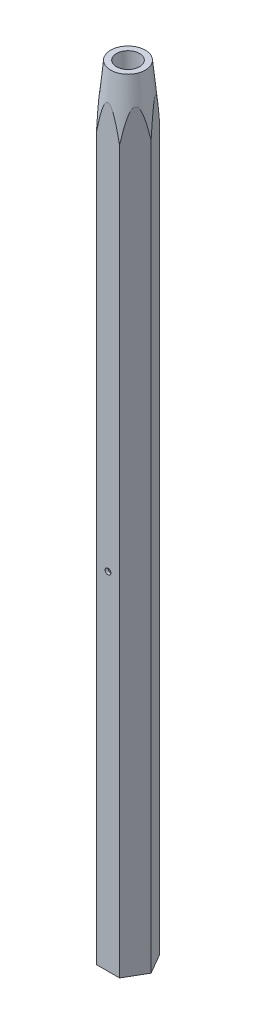
from build123d import *

# Parameters (mm, degrees)
CROQUIS1_R              = 4
CROQUIS1_R_2            = 3
SALIENTE_EXTRUIR1_DEPTH = 125
CORTAR_EXTRUIR1_DEPTH   = 136.11846654
REDONDEO1_R             = 4
CROQUIS15_R             = 3.25
CROQUIS15_R_2           = 3.15
CORTAR_EXTRUIR2_DEPTH   = 0.05
CROQUIS17_R             = 0.5
CORTAR_EXTRUIR3_DEPTH   = 1


with BuildPart() as part:
    # Croquis1 → Saliente-Extruir1 (new body)
    with BuildSketch(Plane(origin=(0, 0, 0), x_dir=(1, 0, 0), z_dir=(0, 1, 0))):
        with Locations(Location((0, 0, 0), (0, 0, 270))):
            Circle(CROQUIS1_R)
        with Locations(Location((0, 0, 0), (0, 0, 270))):
            Circle(CROQUIS1_R_2, mode=Mode.SUBTRACT)
    extrude(amount=SALIENTE_EXTRUIR1_DEPTH)

    # Croquis13 → Revolución1 (revolve)
    with BuildSketch(Plane.XY, mode=Mode.PRIVATE) as revoluci_n1_sk:
        with BuildLine():
            Line((-4, 125), (-3, 135))
            Line((-3, 135), (-2, 135))
            Line((-2, 135), (-2, 127.267949192))
            ThreePointArc((-2, 127.267949192), (-2.068148347, 126.750311102), (-2.267949192, 126.267949192))
            Line((-2.267949192, 126.267949192), (-3, 125))
            Line((-3, 125), (-4, 125))
        make_face()
    revolve(revoluci_n1_sk.sketch.rotate(Axis((0, 125, 0), (0, 1, 0)), 270), axis=Axis((0, 125, 0), (0, 1, 0)))

    # Croquis14 → Cortar-Extruir1 (cut, through all)
    with BuildSketch(Plane.XZ):
        with BuildLine():
            Line((2, -3.464101615), (-2, -3.464101615))
            ThreePointArc((-2, -3.464101615), (0, -4), (2, -3.464101615))
        make_face()
        with BuildLine():
            Line((4, 0), (2, -3.464101615))
            ThreePointArc((2, -3.464101615), (3.464101615, -2), (4, 0))
        make_face()
        with BuildLine():
            ThreePointArc((4, 0), (3.464101615, 2), (2, 3.464101615))
            Line((2, 3.464101615), (4, 0))
        make_face()
        with BuildLine():
            ThreePointArc((2, 3.464101615), (0, 4), (-2, 3.464101615))
            Line((-2, 3.464101615), (2, 3.464101615))
        make_face()
        with BuildLine():
            ThreePointArc((-2, 3.464101615), (-3.464101615, 2), (-4, 0))
            Line((-4, 0), (-2, 3.464101615))
        make_face()
        with BuildLine():
            Line((-2, -3.464101615), (-4, 0))
            ThreePointArc((-4, 0), (-3.464101615, -2), (-2, -3.464101615))
        make_face()
    extrude(amount=-CORTAR_EXTRUIR1_DEPTH, mode=Mode.SUBTRACT)

    # Redondeo1
    redondeo1_edges = [part.edges().sort_by_distance(p)[0] for p in [
        (-3, 125, 0),
    ]]
    fillet(redondeo1_edges, radius=REDONDEO1_R)

    # Croquis15 → Cortar-Extruir2 (cut)
    with BuildSketch(Plane.XZ):
        with Locations(Location((0, 0, 0), (0, 0, 270))):
            Circle(CROQUIS15_R)
        with Locations(Location((0, 0, 0), (0, 0, 270))):
            Circle(CROQUIS15_R_2, mode=Mode.SUBTRACT)
    extrude(amount=-CORTAR_EXTRUIR2_DEPTH, mode=Mode.SUBTRACT)

    # Croquis17 → Cortar-Extruir3 (cut)
    with BuildSketch(Plane.XY.offset(3.464101615)):
        with Locations((0, 60)):
            Circle(CROQUIS17_R)
    extrude(amount=-CORTAR_EXTRUIR3_DEPTH, mode=Mode.SUBTRACT)


solid = part.part
